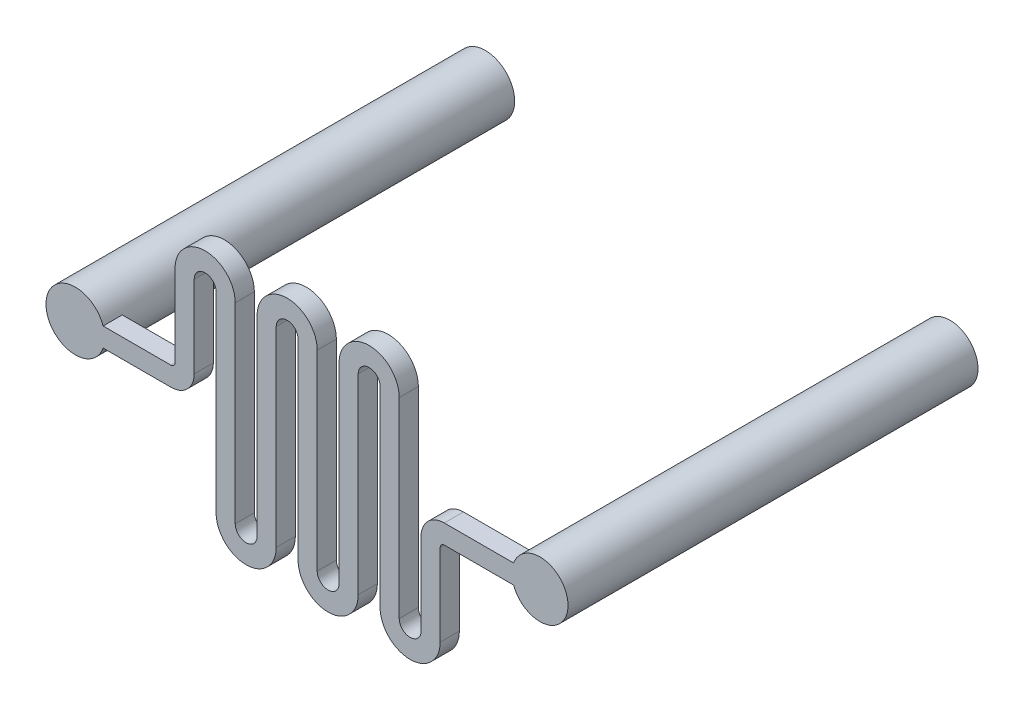
from build123d import *

# Parameters (mm, degrees)
BOSS_EXTRUDE1_DEPTH = 1.4
SKETCH3_W           = 2.15
SKETCH3_H           = 30
SKETCH4_W           = 2.052341434
SKETCH4_H           = 30
SKETCH5_R           = 1.5
CUT_EXTRUDE1_DEPTH  = 28


with BuildPart() as part:
    # Sketch2 → Boss-Extrude1 (new body)
    with BuildSketch(Plane.XY):
        with BuildLine():
            Line((-20.5, -0.7), (-13.5, -0.7))
            ThreePointArc((-13.5, -0.7), (-12.297918472, -0.202081528), (-11.8, 1))
            Line((-11.8, 1), (-11.8, 7))
            ThreePointArc((-11.8, 7), (-11, 7.8), (-10.2, 7))
            Line((-10.2, 7), (-10.2, 0))
            Line((-10.2, 0), (-10.2, -7))
            ThreePointArc((-10.2, -7), (-8, -9.2), (-5.8, -7))
            Line((-5.8, -7), (-5.8, 0))
            Line((-5.8, 0), (-5.8, 7))
            ThreePointArc((-5.8, 7), (-5, 7.8), (-4.2, 7))
            Line((-4.2, 7), (-4.2, 0))
            Line((-4.2, 0), (-4.2, -7))
            ThreePointArc((-4.2, -7), (-2, -9.2), (0.2, -7))
            Line((0.2, -7), (0.2, 0))
            Line((0.2, 0), (0.2, 7))
            ThreePointArc((0.2, 7), (1, 7.8), (1.8, 7))
            Line((1.8, 7), (1.8, 0))
            Line((1.8, 0), (1.8, -7))
            ThreePointArc((1.8, -7), (4, -9.2), (6.2, -7))
            Line((6.2, -7), (6.2, -1))
            ThreePointArc((6.2, -1), (6.287867966, -0.787867966), (6.5, -0.7))
            Line((6.5, -0.7), (13.5, -0.7))
            ThreePointArc((13.5, -0.7), (14.2, 0), (13.5, 0.7))
            Line((13.5, 0.7), (6.5, 0.7))
            ThreePointArc((6.5, 0.7), (5.297918472, 0.202081528), (4.8, -1))
            Line((4.8, -1), (4.8, -7))
            ThreePointArc((4.8, -7), (4, -7.8), (3.2, -7))
            Line((3.2, -7), (3.2, 0))
            Line((3.2, 0), (3.2, 7))
            ThreePointArc((3.2, 7), (1, 9.2), (-1.2, 7))
            Line((-1.2, 7), (-1.2, 0))
            Line((-1.2, 0), (-1.2, -7))
            ThreePointArc((-1.2, -7), (-2, -7.8), (-2.8, -7))
            Line((-2.8, -7), (-2.8, 0))
            Line((-2.8, 0), (-2.8, 7))
            ThreePointArc((-2.8, 7), (-5, 9.2), (-7.2, 7))
            Line((-7.2, 7), (-7.2, 0))
            Line((-7.2, 0), (-7.2, -7))
            ThreePointArc((-7.2, -7), (-8, -7.8), (-8.8, -7))
            Line((-8.8, -7), (-8.8, 0))
            Line((-8.8, 0), (-8.8, 7))
            ThreePointArc((-8.8, 7), (-11, 9.2), (-13.2, 7))
            Line((-13.2, 7), (-13.2, 1))
            ThreePointArc((-13.2, 1), (-13.287867966, 0.787867966), (-13.5, 0.7))
            Line((-13.5, 0.7), (-20.5, 0.7))
            ThreePointArc((-20.5, 0.7), (-21.2, 0), (-20.5, -0.7))
        make_face()
    extrude(amount=BOSS_EXTRUDE1_DEPTH)

    # Sketch3 → Revolve1 (revolve)
    with BuildSketch(Plane(origin=(0, 0, 0), x_dir=(1, 0, 0), z_dir=(0, 1, 0)), mode=Mode.PRIVATE) as revolve1_sk:
        with Locations((-21.575, 13.6)):
            Rectangle(SKETCH3_W, SKETCH3_H)
    revolve(revolve1_sk.sketch.rotate(Axis((-20.5, 0, 1.4), (0, 0, -1)), 180), axis=Axis((-20.5, 0, 1.4), (0, 0, -1)))

    # Sketch4 → Revolve2 (revolve)
    with BuildSketch(Plane(origin=(0, 0, 0), x_dir=(1, 0, 0), z_dir=(0, 1, 0))):
        with Locations((14.526170717, 13.6)):
            Rectangle(SKETCH4_W, SKETCH4_H)
    revolve(axis=Axis((13.5, 0, 1.4), (0, 0, -1)))

    # Sketch5 → Cut-Extrude1 (cut)
    with BuildSketch(Plane(origin=(0, 0, -28.6), x_dir=(-1, 0, 0), z_dir=(0, 0, -1))):
        with Locations((-13.5, 0)):
            Circle(SKETCH5_R)
        with Locations((20.5, 0)):
            Circle(SKETCH5_R)
    extrude(amount=-CUT_EXTRUDE1_DEPTH, mode=Mode.SUBTRACT)


solid = part.part
